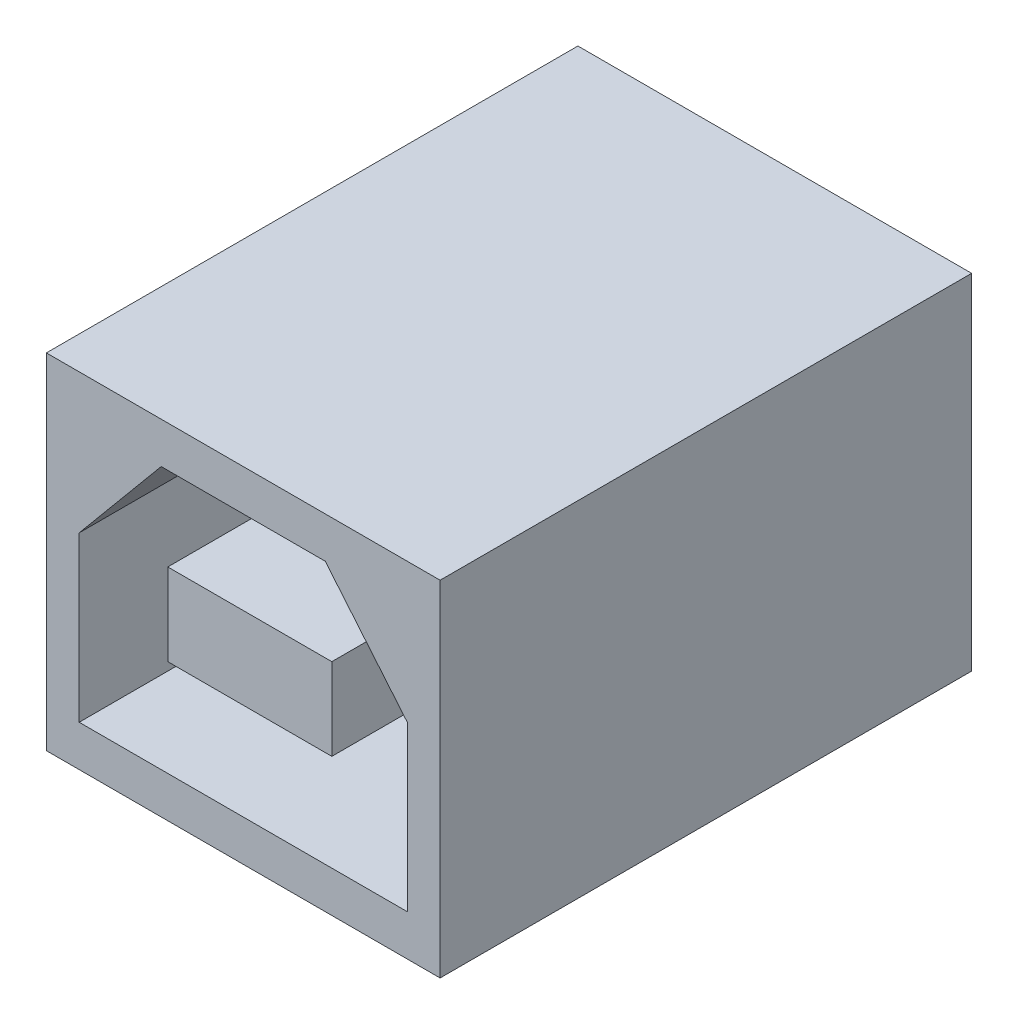
from build123d import *

# Parameters (mm, degrees)
ESQUISSE1_W             = 12
ESQUISSE1_H             = 10.5
BOSS_EXTRU_1_DEPTH      = 16.2
ENL_V_MAT_EXTRU_1_DEPTH = 14
ESQUISSE3_W             = 5
ESQUISSE3_H             = 2.5
BOSS_EXTRU_2_DEPTH      = 16


with BuildPart() as part:
    # Esquisse1 → Boss.-Extru.1 (new body)
    with BuildSketch(Plane.XY):
        Rectangle(ESQUISSE1_W, ESQUISSE1_H)
    extrude(amount=-BOSS_EXTRU_1_DEPTH)

    # Esquisse2 → Enlèv. mat.-Extru.1 (cut)
    with BuildSketch(Plane.XY):
        Polygon((-5, 1), (-2.5, 4), (2.5, 4), (5, 1), (5, -4), (-5, -4), align=None)
    extrude(amount=-ENL_V_MAT_EXTRU_1_DEPTH, mode=Mode.SUBTRACT)

    # Esquisse3 → Boss.-Extru.2 (add)
    with BuildSketch(Plane(origin=(0, 0, -16.2), x_dir=(-1, 0, 0), z_dir=(0, 0, -1))):
        Rectangle(ESQUISSE3_W, ESQUISSE3_H)
    extrude(amount=-BOSS_EXTRU_2_DEPTH)


solid = part.part
